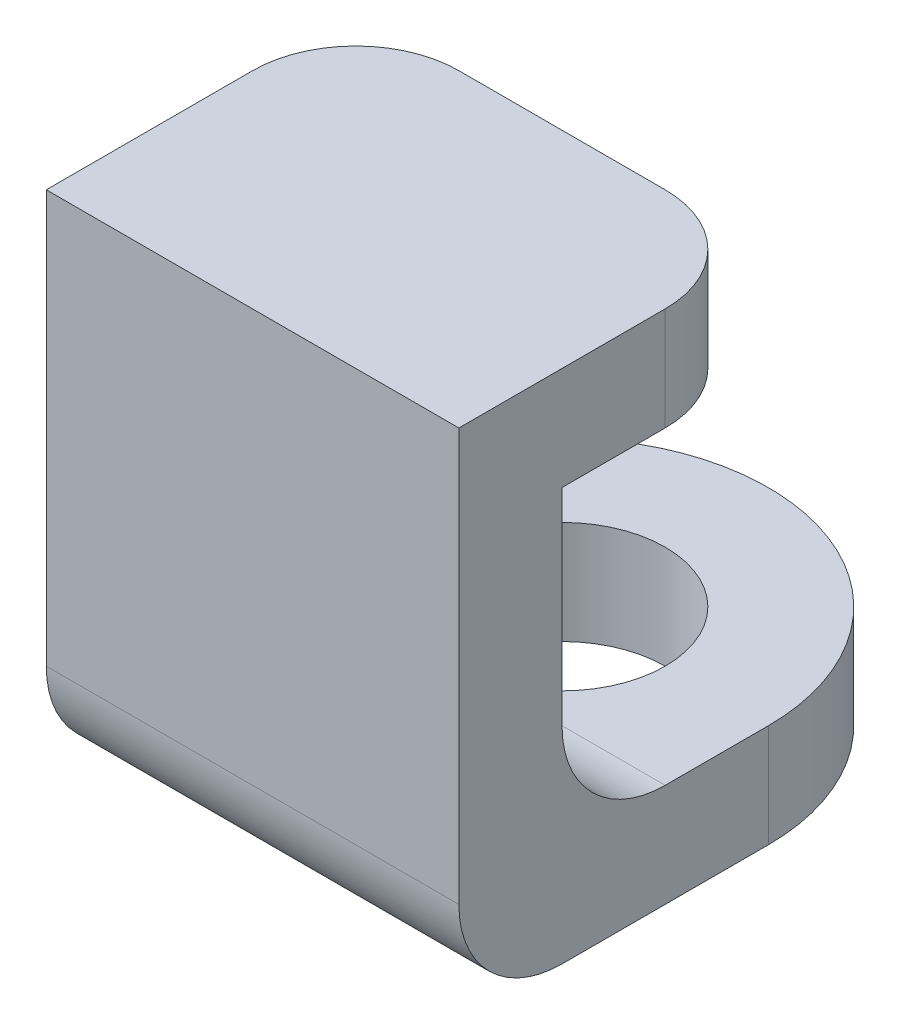
from build123d import *

# Parameters (mm, degrees)
EXTRUDE_1_DEPTH          = 4
CUT_EXTRUDE_1_DEPTH      = 3
CUT_EXTRUDE_2_DEPTH      = 8.071067812
CUT_EXTRUDE_2_DEPTH_BACK = 3
SKETCH_4_R               = 1
CUT_EXTRUDE_3_DEPTH      = 3


with BuildPart() as part:
    # 草圖1 → 填料-伸長1 (new body)
    with BuildSketch(Plane(origin=(0, 0, 0), x_dir=(0, 0, -1), z_dir=(1, 0, 0))):
        with BuildLine():
            Line((0, 0), (-3, 0))
            Line((-3, 0), (-3, -4))
            ThreePointArc((-3, -4), (-2.707106781, -4.707106781), (-2, -5))
            Line((-2, -5), (2, -5))
            Line((2, -5), (2, -4))
            Line((2, -4), (-1, -4))
            ThreePointArc((-1, -4), (-1.707106781, -3.707106781), (-2, -3))
            Line((-2, -3), (-2, -1))
            Line((-2, -1), (0, -1))
            Line((0, -1), (0, 0))
        make_face()
    extrude(amount=EXTRUDE_1_DEPTH)

    # 草圖2 → 除料-伸長1 (cut)
    with BuildSketch(Plane(origin=(0, 0, 0), x_dir=(1, 0, 0), z_dir=(0, 1, 0))):
        with BuildLine():
            ThreePointArc((0, -1), (0.292893219, -0.292893219), (1, 0))
            Line((1, 0), (0, 0))
            Line((0, 0), (0, -1))
        make_face()
        with BuildLine():
            Line((4, 0), (3, 0))
            ThreePointArc((3, 0), (3.707106781, -0.292893219), (4, -1))
            Line((4, -1), (4, 0))
        make_face()
    extrude(amount=-CUT_EXTRUDE_1_DEPTH, mode=Mode.SUBTRACT)

    # 草圖3 → 除料-伸長2 (cut, two sides: drawn at the far end of the back side and taken through both)
    with BuildSketch(Plane.XZ.offset(5).offset(-CUT_EXTRUDE_2_DEPTH_BACK)):
        with BuildLine():
            Line((0, -0.361789115), (0, -2))
            Line((0, -2), (2, -2))
            ThreePointArc((2, -2), (0.585786438, -1.414213562), (0, 0))
            Line((0, 0), (0, -0.361789115))
        make_face()
        with BuildLine():
            ThreePointArc((4, 0), (3.414213562, -1.414213562), (2, -2))
            Line((2, -2), (4, -2))
            Line((4, -2), (4, -0.361789115))
            Line((4, -0.361789115), (4, 0))
        make_face()
    extrude(amount=CUT_EXTRUDE_2_DEPTH + CUT_EXTRUDE_2_DEPTH_BACK, mode=Mode.SUBTRACT)

    # 草圖4 → 除料-伸長3 (cut)
    with BuildSketch(Plane.XZ.offset(5)):
        with Locations(Location((2, 0, 0), (0, 0, 270))):
            Circle(SKETCH_4_R)
    extrude(amount=-CUT_EXTRUDE_3_DEPTH, mode=Mode.SUBTRACT)


solid = part.part
